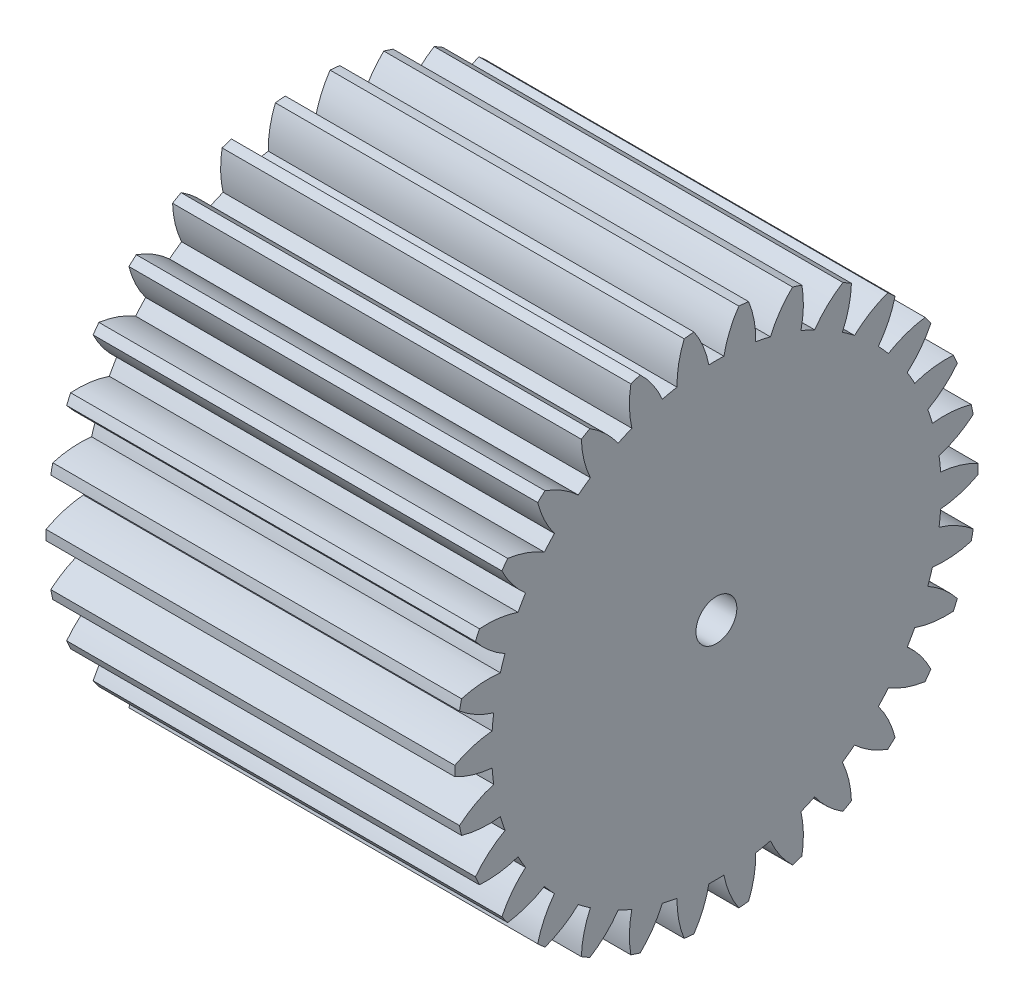
from build123d import *

# Parameters (mm, degrees)
BASPROSKE_W     = 50
BASPROSKE_H     = 32
TOOTHCUT_DEPTH  = 68.4388612
TEETHCUTS_COUNT = 30
BORSKE_R        = 2.5
BORE_DEPTH      = 50.0000508


with BuildPart() as part:
    # BasProSke → Base-Revolve (revolve)
    with BuildSketch(Plane(origin=(0, 0, 0), x_dir=(1, 0, 0), z_dir=(0, 1, 0)), mode=Mode.PRIVATE) as base_revolve_sk:
        with Locations((25, 16)):
            Rectangle(BASPROSKE_W, BASPROSKE_H)
    revolve(base_revolve_sk.sketch.rotate(Axis((-10, 0, 0), (1, 0, 0)), 180), axis=Axis((-10, 0, 0), (1, 0, 0)))

    # TooCutSke → ToothCut (cut, through all)
    with BuildSketch(Plane(origin=(0, 0, 0), x_dir=(0, 0, -1), z_dir=(1, 0, 0))):
        with BuildLine():
            ThreePointArc((0.918551563, 27.483654488), (0, 27.499), (-0.918551563, 27.483654488))
            ThreePointArc((-0.918551563, 27.483654488), (-1.617208176, 29.787801627), (-2.761784709, 31.906093311))
            ThreePointArc((-2.761784709, 31.906093311), (0, 32.0254), (2.761784709, 31.906093311))
            ThreePointArc((2.761784709, 31.906093311), (1.617208176, 29.787801627), (0.918551563, 27.483654488))
        make_face()
    toothcut = extrude(amount=TOOTHCUT_DEPTH, mode=Mode.SUBTRACT)

    # TeethCuts: ToothCut ×30 about axis
    teethcuts_axis = Axis((0, 0, 0), (1, 0, 0))
    for i in range(1, TEETHCUTS_COUNT):
        add(toothcut.rotate(teethcuts_axis, i * 360 / TEETHCUTS_COUNT), mode=Mode.SUBTRACT)

    # BorSke → Bore (cut, symmetric)
    with BuildSketch(Plane(origin=(0, 0, 0), x_dir=(0, 0, -1), z_dir=(1, 0, 0))):
        with Locations(Location((0, 0, 0), (0, 0, 180))):
            Circle(BORSKE_R)
    extrude(amount=BORE_DEPTH, both=True, mode=Mode.SUBTRACT)


solid = part.part
